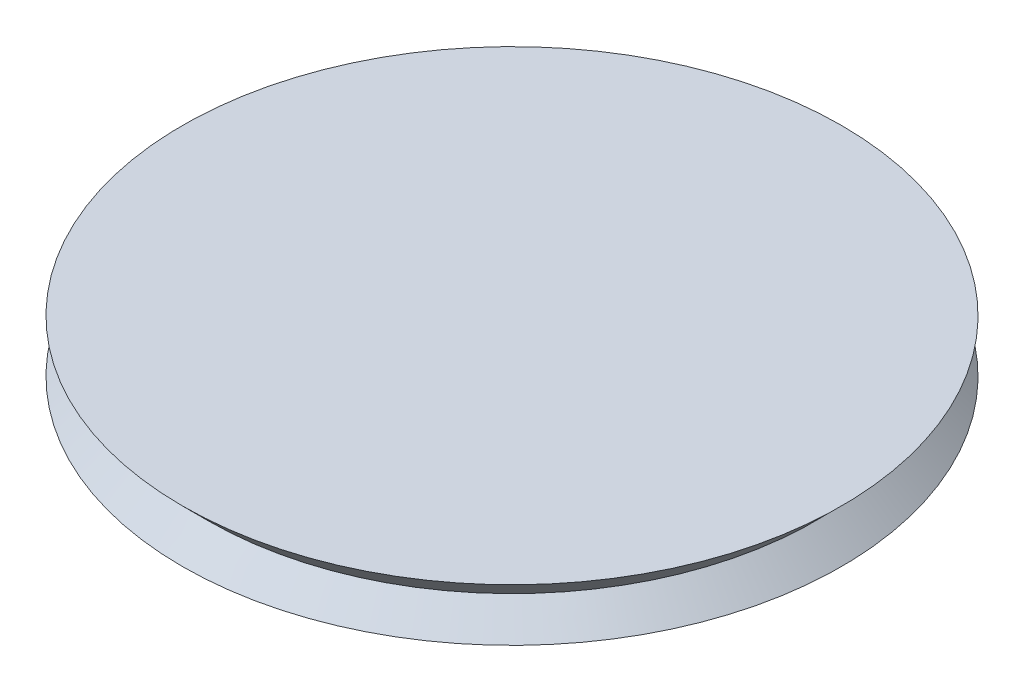
from build123d import *

# Parameters (mm, degrees)
SKETCH1_R           = 6.1
SKETCH1_R_2         = 1.6
BOSS_EXTRUDE1_DEPTH = 7.4
SKETCH2_R           = 1.8
CUT_EXTRUDE2_DEPTH  = 4
SKETCH3_R           = 1.2
CUT_EXTRUDE3_DEPTH  = 1
SKETCH4_R           = 52.225
BOSS_EXTRUDE2_DEPTH = 8
FILLET1_R           = 1


with BuildPart() as part:
    # Sketch1 → Boss-Extrude1 (new body)
    # profile 1 of 3: a face of its own
    with BuildSketch(Plane(origin=(0, 0, 0), x_dir=(1, 0, 0), z_dir=(0, 1, 0))):
        Circle(SKETCH1_R)
        with Locations(Location((0, 0, 0), (0, 0, 270))):
            Circle(SKETCH1_R_2, mode=Mode.SUBTRACT)
    # profile 2 of 3: a face of its own
    with BuildSketch(Plane(origin=(0, 0, 0), x_dir=(1, 0, 0), z_dir=(0, 1, 0))):
        with BuildLine():
            ThreePointArc((0, -6.1), (-4.313351365, -4.313351365), (-6.1, 0))
            Line((-6.1, 0), (-6.1, -6.1))
            Line((-6.1, -6.1), (0, -6.1))
        make_face()
    # profile 3 of 3: a face of its own
    with BuildSketch(Plane(origin=(0, 0, 0), x_dir=(1, 0, 0), z_dir=(0, 1, 0))):
        with BuildLine():
            ThreePointArc((-6.1, 0), (-4.313351365, 4.313351365), (0, 6.1))
            Line((0, 6.1), (-6.1, 6.1))
            Line((-6.1, 6.1), (-6.1, 0))
        make_face()
    extrude(amount=BOSS_EXTRUDE1_DEPTH)

    # Sketch2 → Cut-Extrude2 (cut)
    with BuildSketch(Plane.ZY.offset(6.1)):
        with Locations((0, 3.7)):
            Circle(SKETCH2_R)
    extrude(amount=-CUT_EXTRUDE2_DEPTH, mode=Mode.SUBTRACT)

    # Sketch3 → Cut-Extrude3 (cut)
    with BuildSketch(Plane.ZY.offset(2.1)):
        with Locations((0, 3.7)):
            Circle(SKETCH3_R)
    extrude(amount=-CUT_EXTRUDE3_DEPTH, mode=Mode.SUBTRACT)

    # Sketch4 → Boss-Extrude2 (add)
    with BuildSketch(Plane(origin=(0, 7.4, 0), x_dir=(1, 0, 0), z_dir=(0, 1, 0))):
        with Locations(Location((0, 0, 0), (0, 0, 270))):
            Circle(SKETCH4_R)
    extrude(amount=BOSS_EXTRUDE2_DEPTH)

    # Sketch6 → Cut-Revolve1 (revolve, cut)
    with BuildSketch(Plane(origin=(0, 0, 0), x_dir=(0, 0, -1), z_dir=(1, 0, 0)), mode=Mode.PRIVATE) as cut_revolve1_sk:
        Polygon((-46.225, 11.4), (-50.225, 7.4), (-52.225, 7.4), (-52.225, 15.4), (-50.225, 15.4), align=None)
    revolve(cut_revolve1_sk.sketch.rotate(Axis((0, 0, 0), (0, 1, 0)), 180), axis=Axis((0, 0, 0), (0, 1, 0)), mode=Mode.SUBTRACT)

    # Fillet1
    fillet1_edges = [part.edges().sort_by_distance(p)[0] for p in [
        (6.1, 7.4, 0),
        (-3.05, 7.4, -6.1),
        (-6.1, 7.4, 0),
        (-3.05, 7.4, 6.1),
    ]]
    fillet(fillet1_edges, radius=FILLET1_R)


solid = part.part
